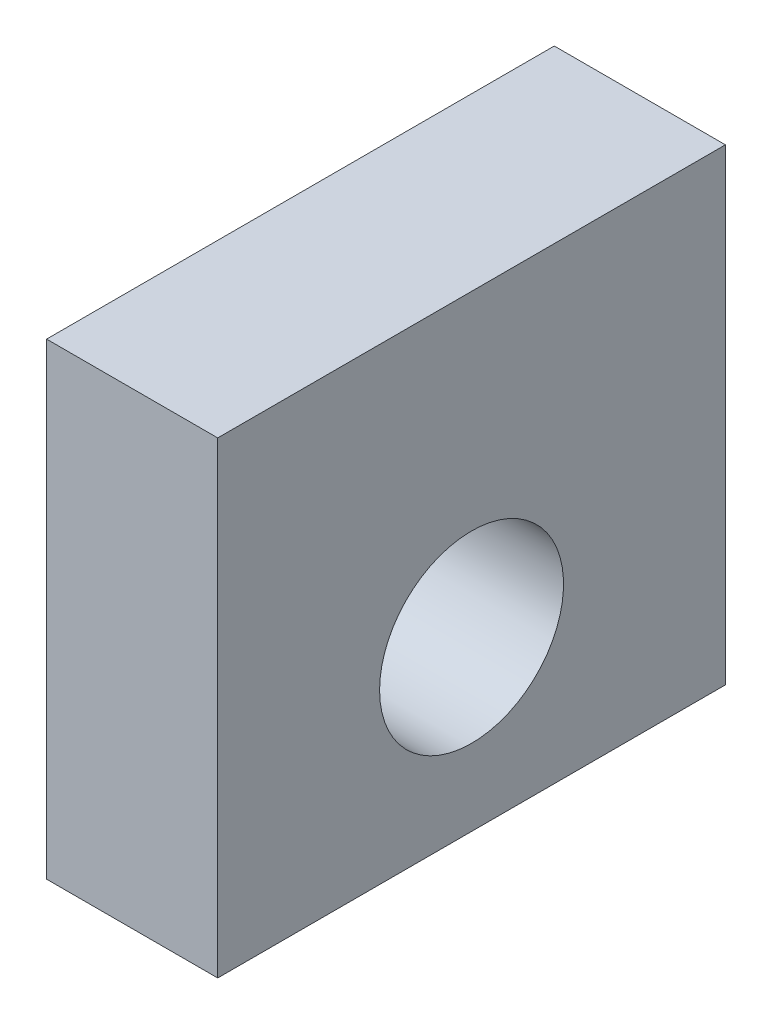
from build123d import *

# Parameters (mm, degrees)
BLOCK_SKETCH_W     = 17.8
BLOCK_SKETCH_H     = 16.4
BLOCK_DEPTH        = 3
TUBE_HOLE_SKETCH_R = 3.225
TUBE_HOLE_DEPTH    = 4


with BuildPart() as part:
    # Block Sketch → Block (new, symmetric)
    with BuildSketch(Plane(origin=(0, 0, 0), x_dir=(0, 0, -1), z_dir=(1, 0, 0))):
        with Locations((0, 90.3)):
            Rectangle(BLOCK_SKETCH_W, BLOCK_SKETCH_H)
    extrude(amount=BLOCK_DEPTH, both=True)

    # Tube Hole Sketch → Tube Hole (cut, symmetric)
    with BuildSketch(Plane(origin=(0, 0, 0), x_dir=(0, 0, -1), z_dir=(1, 0, 0))):
        with Locations((0, 88)):
            Circle(TUBE_HOLE_SKETCH_R)
    extrude(amount=TUBE_HOLE_DEPTH, both=True, mode=Mode.SUBTRACT)


solid = part.part
